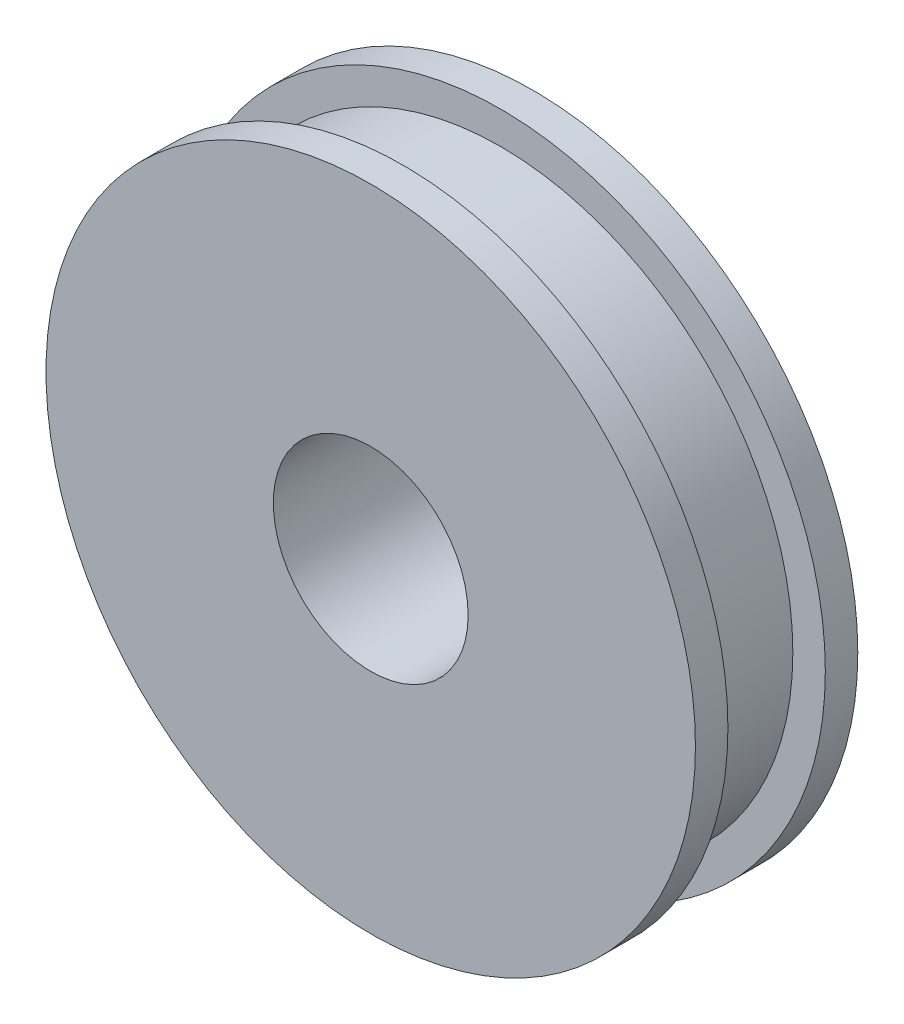
from build123d import *

# Parameters (mm, degrees)
SKETCH1_R           = 10
SKETCH1_R_2         = 3
BOSS_EXTRUDE1_DEPTH = 5
CUT_EXTRUDE1_START  = 1
SKETCH1_3_R         = 10
SKETCH1_3_R_2       = 9
CUT_EXTRUDE1_DEPTH  = 3


with BuildPart() as part:
    # Sketch1 → Boss-Extrude1 (new body)
    with BuildSketch(Plane.XY):
        Circle(SKETCH1_R)
        Circle(SKETCH1_R_2, mode=Mode.SUBTRACT)
    extrude(amount=BOSS_EXTRUDE1_DEPTH)

    # Sketch1<3> → Cut-Extrude1 (cut)
    with BuildSketch(Plane.XY.offset(CUT_EXTRUDE1_START)):
        Circle(SKETCH1_3_R)
        Circle(SKETCH1_3_R_2, mode=Mode.SUBTRACT)
    extrude(amount=CUT_EXTRUDE1_DEPTH, mode=Mode.SUBTRACT)


solid = part.part
